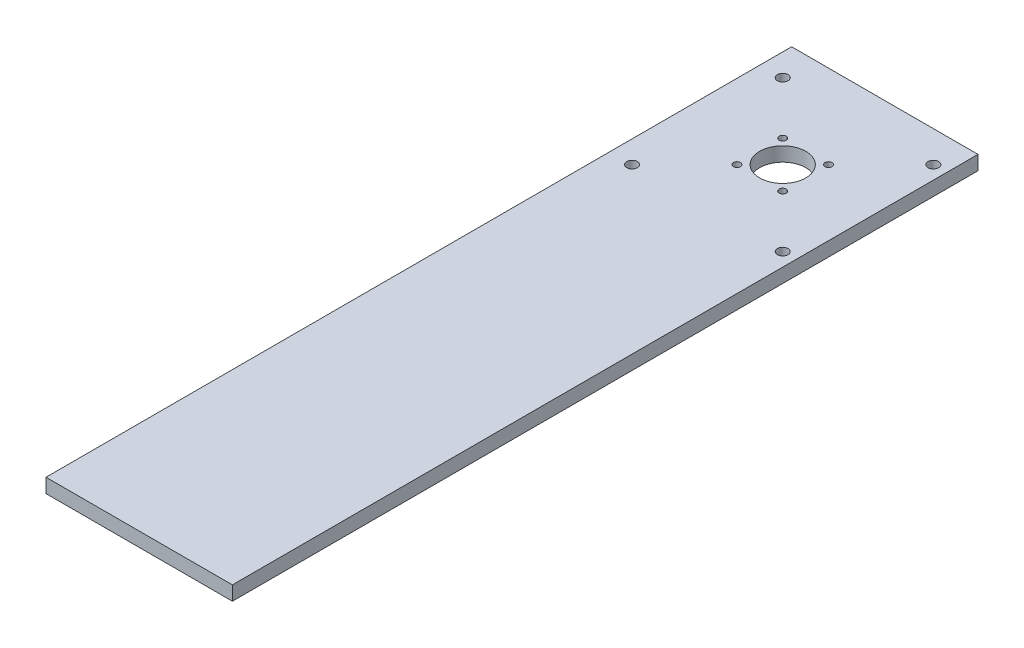
from build123d import *

# Parameters (mm, degrees)
SKETCH1_W           = 105
SKETCH1_H           = 420
SKETCH1_R           = 13
SKETCH1_R_2         = 3
SKETCH1_R_3         = 2
BOSS_EXTRUDE1_DEPTH = 8


with BuildPart() as part:
    # Sketch1 → Boss-Extrude1 (new body)
    with BuildSketch(Plane(origin=(0, 0, 0), x_dir=(1, 0, 0), z_dir=(0, 1, 0))):
        with Locations((-2.5, 0)):
            Rectangle(SKETCH1_W, SKETCH1_H)
        with Locations(Location((0, 150, 0), (0, 0, 270))):
            Circle(SKETCH1_R, mode=Mode.SUBTRACT)
        with Locations(Location((-42.426406871, 107.573593129, 0), (0, 0, 270))):
            Circle(SKETCH1_R_2, mode=Mode.SUBTRACT)
        with Locations(Location((-42.426406871, 192.426406871, 0), (0, 0, 270))):
            Circle(SKETCH1_R_2, mode=Mode.SUBTRACT)
        with Locations(Location((42.426406871, 192.426406871, 0), (0, 0, 270))):
            Circle(SKETCH1_R_2, mode=Mode.SUBTRACT)
        with Locations(Location((42.426406871, 107.573593129, 0), (0, 0, 270))):
            Circle(SKETCH1_R_2, mode=Mode.SUBTRACT)
        with Locations(Location((-12.904698757, 137.095301243, 0), (0, 0, 270))):
            Circle(SKETCH1_R_3, mode=Mode.SUBTRACT)
        with Locations(Location((-12.904698757, 162.904698757, 0), (0, 0, 270))):
            Circle(SKETCH1_R_3, mode=Mode.SUBTRACT)
        with Locations(Location((12.904698757, 162.904698757, 0), (0, 0, 270))):
            Circle(SKETCH1_R_3, mode=Mode.SUBTRACT)
        with Locations(Location((12.904698757, 137.095301243, 0), (0, 0, 270))):
            Circle(SKETCH1_R_3, mode=Mode.SUBTRACT)
    extrude(amount=BOSS_EXTRUDE1_DEPTH)


solid = part.part
